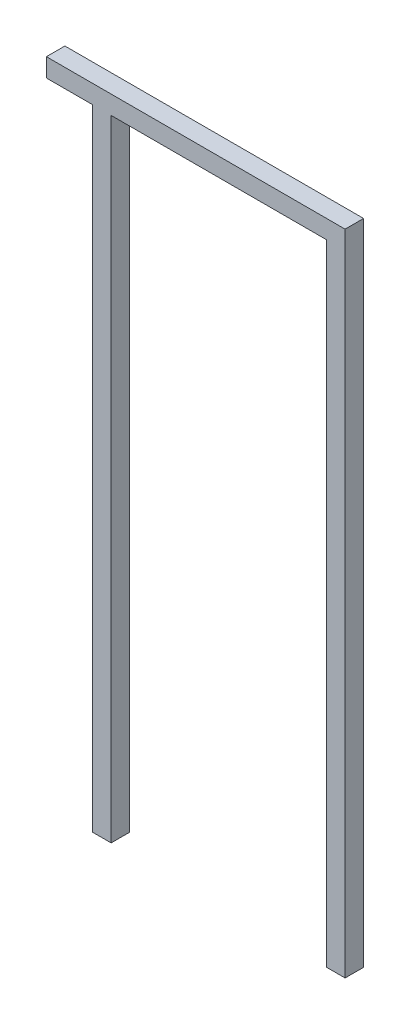
from build123d import *

# Parameters (mm, degrees)
BOSS_EXTRUDE1_DEPTH = 20


with BuildPart() as part:
    # Sketch1 → Boss-Extrude1 (new body)
    with BuildSketch(Plane.XY):
        Polygon((-279.662582645, 140.993915289), (43.337417355, 140.993915289), (43.337417355, -560.336084711), (23.337417355, -560.336084711), (23.337417355, 120.993915289), (-209.662582645, 120.993915289), (-209.662582645, -560.336084711), (-229.662582645, -560.336084711), (-229.662582645, 120.993915289), (-279.662582645, 120.993915289), align=None)
    extrude(amount=BOSS_EXTRUDE1_DEPTH)


solid = part.part
